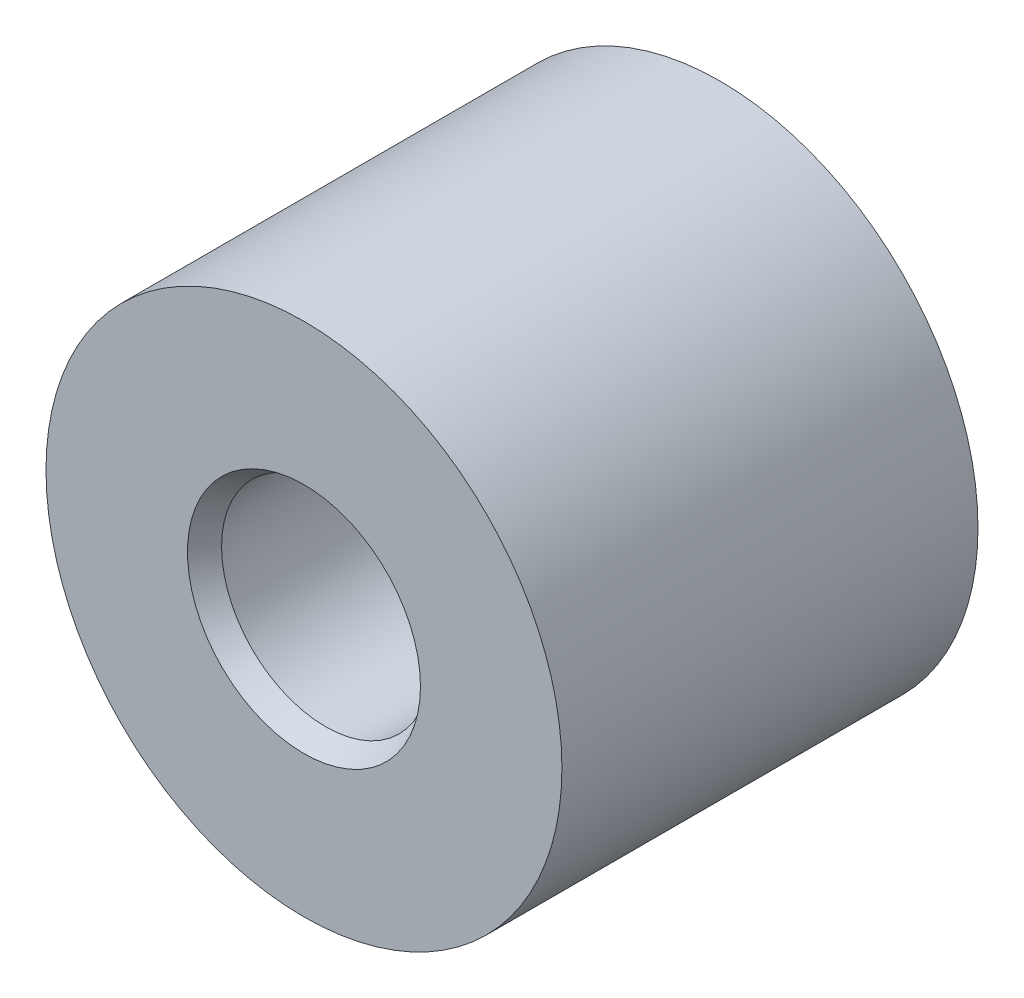
from build123d import *

# Parameters (mm, degrees)
SKETCH2_R                            = 3.1
BOSS_EXTRUDE1_DEPTH                  = 5
F_2_5_2_5_DIAMETER_HOLE1_D           = 2.5
F_2_5_2_5_DIAMETER_HOLE1_CSINK_D     = 2.8
F_2_5_2_5_DIAMETER_HOLE1_CSINK_ANGLE = 60


with BuildPart() as part:
    # Sketch2 → Boss-Extrude1 (new body)
    with BuildSketch(Plane.XY):
        Circle(SKETCH2_R)
    extrude(amount=-BOSS_EXTRUDE1_DEPTH)

    # Ø2.5 (2.5) Diameter Hole1 (through all)
    with Locations(Plane.XY):
        with Locations((0, 0)):
            CounterSinkHole(F_2_5_2_5_DIAMETER_HOLE1_D / 2, F_2_5_2_5_DIAMETER_HOLE1_CSINK_D / 2, counter_sink_angle=F_2_5_2_5_DIAMETER_HOLE1_CSINK_ANGLE)


solid = part.part
